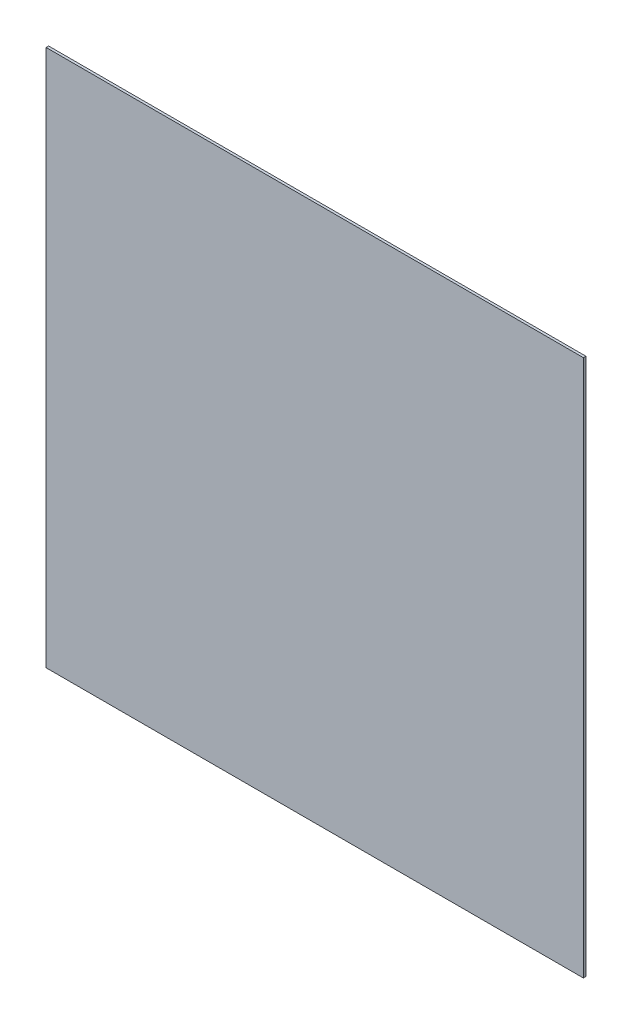
from build123d import *

# Parameters (mm, degrees)
SKETCH2_W           = 320
SKETCH2_H           = 320
BOSS_EXTRUDE2_DEPTH = 1.5


with BuildPart() as part:
    # Sketch2 → Boss-Extrude2 (new body)
    with BuildSketch(Plane.XY):
        Rectangle(SKETCH2_W, SKETCH2_H)
    extrude(amount=BOSS_EXTRUDE2_DEPTH)


solid = part.part
